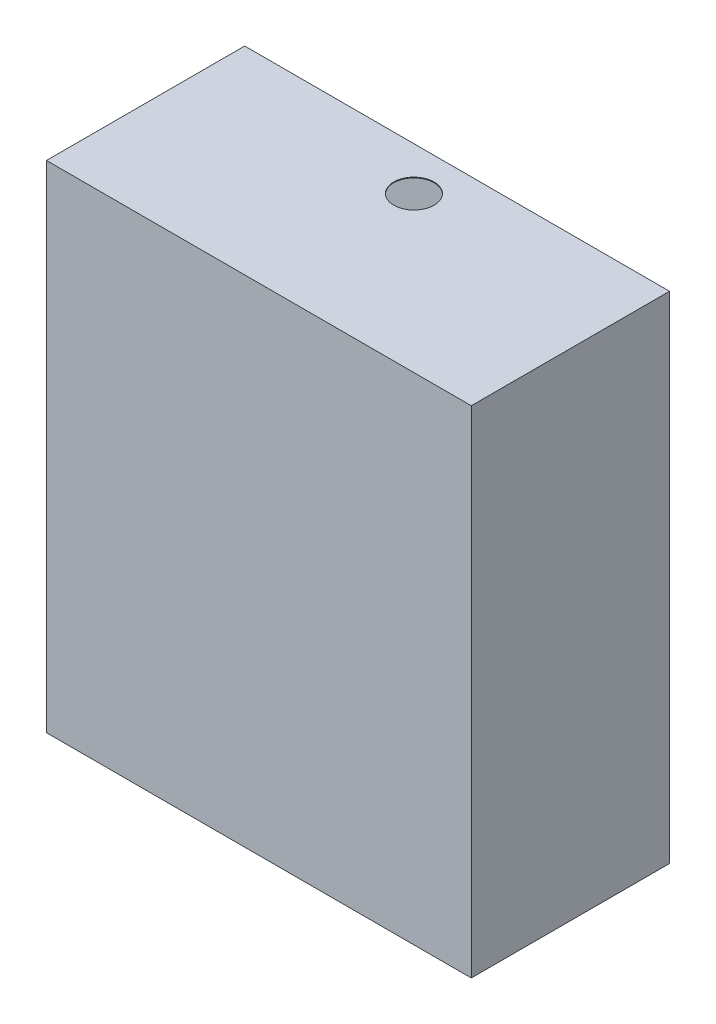
from build123d import *

# Parameters (mm, degrees)
SKETCH_1_W      = 600
SKETCH_1_H      = 700
EXTRUDE_1_DEPTH = 140
SHELL_1_T       = -1
HOLE_WIZARD_1_D = 57


with BuildPart() as part:
    # 草图1 → 凸台-拉伸1 (new, symmetric)
    with BuildSketch(Plane.XY):
        Rectangle(SKETCH_1_W, SKETCH_1_H)
    extrude(amount=EXTRUDE_1_DEPTH, both=True)

    # 抽壳1
    shell_1_openings = [part.faces().sort_by_distance(p)[0] for p in [
        (0, -350, 0),
    ]]
    offset(amount=SHELL_1_T, openings=shell_1_openings, kind=Kind.INTERSECTION)

    # 孔1 (through all)
    with Locations(Plane(origin=(0, 350, 0), x_dir=(1, 0, 0), z_dir=(0, 1, 0))):
        with Locations((0, 79)):
            Hole(HOLE_WIZARD_1_D / 2)


solid = part.part
